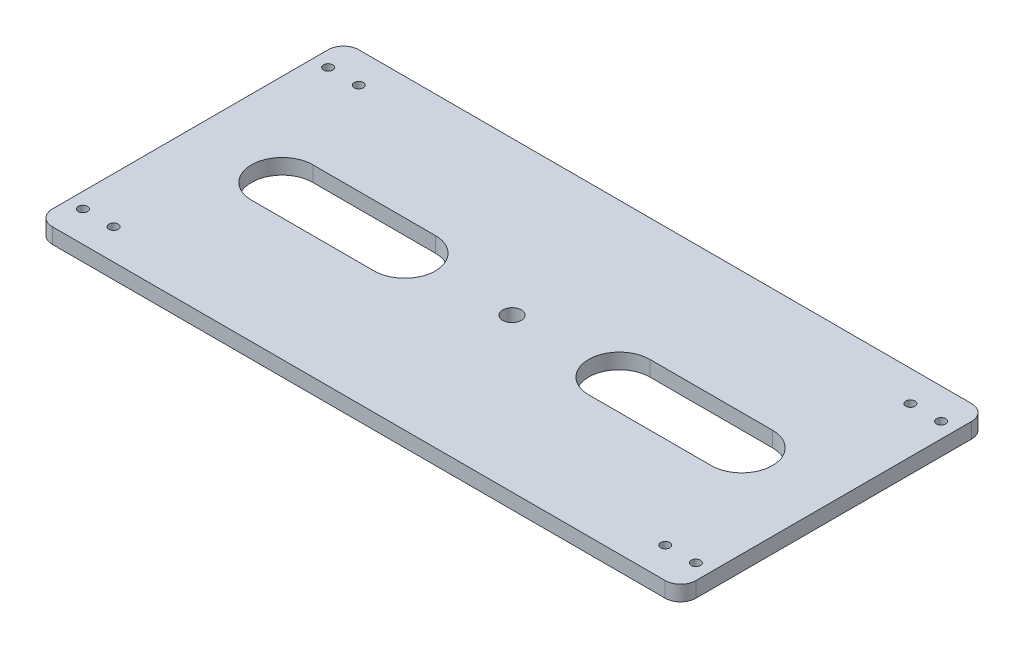
from build123d import *

# Parameters (mm, degrees)
SKETCH_1_W          = 210
SKETCH_1_H          = 100
EXTRUDE_1_DEPTH     = 5
CUT_EXTRUDE_1_DEPTH = 40
SKETCH_4_R          = 3
CUT_EXTRUDE_3_DEPTH = 20
SKETCH_8_R          = 1.5
CUT_EXTRUDE_4_DEPTH = 20
FILLET_1_R          = 5


with BuildPart() as part:
    # 草图1 → 凸台-拉伸1 (new body)
    with BuildSketch(Plane(origin=(0, 0, 0), x_dir=(1, 0, 0), z_dir=(0, 1, 0))):
        with Locations((105, -50)):
            Rectangle(SKETCH_1_W, SKETCH_1_H)
    extrude(amount=EXTRUDE_1_DEPTH)

    # 草图2 → 切除-拉伸1 (cut)
    with BuildSketch(Plane(origin=(0, 5, 0), x_dir=(1, 0, 0), z_dir=(0, 1, 0))):
        with BuildLine():
            Line((30, -40), (70, -40))
            ThreePointArc((70, -40), (80, -50), (70, -60))
            Line((70, -60), (30, -60))
            ThreePointArc((30, -60), (20, -50), (30, -40))
        make_face()
        with BuildLine():
            Line((140, -40), (180, -40))
            ThreePointArc((180, -40), (190, -50), (180, -60))
            Line((180, -60), (140, -60))
            ThreePointArc((140, -60), (130, -50), (140, -40))
        make_face()
    extrude(amount=-CUT_EXTRUDE_1_DEPTH, mode=Mode.SUBTRACT)

    # 草图4 → 切除-拉伸3 (cut)
    with BuildSketch(Plane(origin=(0, 5, 0), x_dir=(1, 0, 0), z_dir=(0, 1, 0))):
        with Locations(Location((105, -50, 0), (0, 0, 270))):
            Circle(SKETCH_4_R)
    extrude(amount=-CUT_EXTRUDE_3_DEPTH, mode=Mode.SUBTRACT)

    # 草图8 → 切除-拉伸4 (cut)
    with BuildSketch(Plane(origin=(0, 5, 0), x_dir=(1, 0, 0), z_dir=(0, 1, 0))):
        with Locations(Location((5, -10, 0), (0, 0, 270))):
            Circle(SKETCH_8_R)
        with Locations(Location((205, -10, 0), (0, 0, 270))):
            Circle(SKETCH_8_R)
        with Locations(Location((205, -90, 0), (0, 0, 270))):
            Circle(SKETCH_8_R)
        with Locations(Location((5, -90, 0), (0, 0, 270))):
            Circle(SKETCH_8_R)
        with Locations(Location((15, -10, 0), (0, 0, 270))):
            Circle(SKETCH_8_R)
        with Locations(Location((15, -90, 0), (0, 0, 270))):
            Circle(SKETCH_8_R)
        with Locations(Location((195, -90, 0), (0, 0, 270))):
            Circle(SKETCH_8_R)
        with Locations(Location((195, -10, 0), (0, 0, 270))):
            Circle(SKETCH_8_R)
    extrude(amount=-CUT_EXTRUDE_4_DEPTH, mode=Mode.SUBTRACT)

    # 圆角1
    fillet_1_edges = [part.edges().sort_by_distance(p)[0] for p in [
        (0, 2.5, 0),
        (210, 2.5, 0),
        (210, 2.5, 100),
        (0, 2.5, 100),
    ]]
    fillet(fillet_1_edges, radius=FILLET_1_R)


solid = part.part
